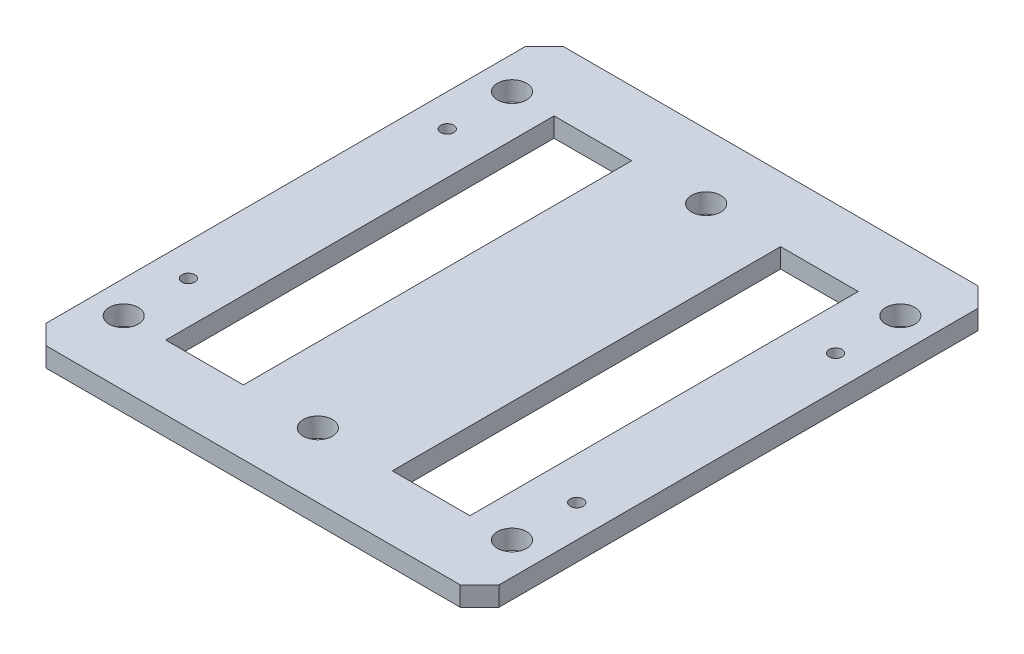
from build123d import *

# Parameters (mm, degrees)
ESQUISSE1_W             = 70
ESQUISSE1_H             = 12
BOSS_EXTRU_1_DEPTH      = 80
ESQUISSE2_W             = 12
ESQUISSE2_H             = 6
ENL_V_MAT_EXTRU_1_DEPTH = 107.976632963
ESQUISSE4_R             = 2.25
ENL_V_MAT_EXTRU_3_DEPTH = 107.976632963
ESQUISSE5_W             = 12
ESQUISSE5_H             = 10
BOSS_EXTRU_2_DEPTH      = 6
CHANFREIN1_SIZE         = 3
ESQUISSE6_R             = 1
ENL_V_MAT_EXTRU_4_DEPTH = 12
ENL_V_START             = -80
ESQUISSE8_W             = 70
ESQUISSE8_H             = 9
ENL_V_MAT_EXTRU_8_DEPTH = 80


with BuildPart() as part:
    # Esquisse1 → Boss.-Extru.1 (new body)
    with BuildSketch(Plane.XY):
        with Locations((35, 6)):
            Rectangle(ESQUISSE1_W, ESQUISSE1_H)
    extrude(amount=BOSS_EXTRU_1_DEPTH)

    # Esquisse2 → Enlèv. mat.-Extru.1 (cut, through all)
    with BuildSketch(Plane.XY.offset(80)):
        with Locations((52.5, 9)):
            Rectangle(ESQUISSE2_W, ESQUISSE2_H)
        with Locations((17.5, 9)):
            Rectangle(ESQUISSE2_W, ESQUISSE2_H)
    extrude(amount=-ENL_V_MAT_EXTRU_1_DEPTH, mode=Mode.SUBTRACT)

    # Esquisse4 → Enlèv. mat.-Extru.3 (cut, through all)
    with BuildSketch(Plane(origin=(0, 12, 0), x_dir=(1, 0, 0), z_dir=(0, 1, 0))):
        with Locations(Location((5, -10, 0), (0, 0, 270))):
            Circle(ESQUISSE4_R)
        with Locations(Location((65, -70, 0), (0, 0, 270))):
            Circle(ESQUISSE4_R)
        with Locations(Location((65, -10, 0), (0, 0, 90))):
            Circle(ESQUISSE4_R)
        with Locations(Location((5, -70, 0), (0, 0, 90))):
            Circle(ESQUISSE4_R)
        with Locations(Location((35, -10, 0), (0, 0, 270))):
            Circle(ESQUISSE4_R)
        with Locations(Location((35, -70, 0), (0, 0, 270))):
            Circle(ESQUISSE4_R)
    extrude(amount=-ENL_V_MAT_EXTRU_3_DEPTH, mode=Mode.SUBTRACT)

    # Esquisse5 → Boss.-Extru.2 (add)
    with BuildSketch(Plane(origin=(0, 12, 0), x_dir=(1, 0, 0), z_dir=(0, 1, 0))):
        with Locations((17.5, -75)):
            Rectangle(ESQUISSE5_W, ESQUISSE5_H)
        with Locations((52.5, -75)):
            Rectangle(ESQUISSE5_W, ESQUISSE5_H)
        with Locations((52.5, -5)):
            Rectangle(ESQUISSE5_W, ESQUISSE5_H)
        with Locations((17.5, -5)):
            Rectangle(ESQUISSE5_W, ESQUISSE5_H)
    extrude(amount=-BOSS_EXTRU_2_DEPTH)

    # Chanfrein1
    chanfrein1_edges = [part.edges().sort_by_distance(p)[0] for p in [
        (70, 6, 80),
        (0, 6, 80),
        (70, 6, 0),
        (0, 6, 0),
    ]]
    chamfer(chanfrein1_edges, length=CHANFREIN1_SIZE)

    # Esquisse6 → Enlèv. mat.-Extru.4 (cut)
    with BuildSketch(Plane(origin=(0, 12, 0), x_dir=(1, 0, 0), z_dir=(0, 1, 0))):
        with Locations(Location((5, -20, 0), (0, 0, 270))):
            Circle(ESQUISSE6_R)
        with Locations(Location((5, -60, 0), (0, 0, 90))):
            Circle(ESQUISSE6_R)
        with Locations(Location((65, -60, 0), (0, 0, 270))):
            Circle(ESQUISSE6_R)
        with Locations(Location((65, -20, 0), (0, 0, 90))):
            Circle(ESQUISSE6_R)
    extrude(amount=-ENL_V_MAT_EXTRU_4_DEPTH, mode=Mode.SUBTRACT)

    # Esquisse8 → Enlèv. mat.-Extru.8 (cut)
    with BuildSketch(Plane.XY.offset(80).offset(ENL_V_START)):
        with Locations((35, 4.5)):
            Rectangle(ESQUISSE8_W, ESQUISSE8_H)
    extrude(amount=ENL_V_MAT_EXTRU_8_DEPTH, mode=Mode.SUBTRACT)


solid = part.part
